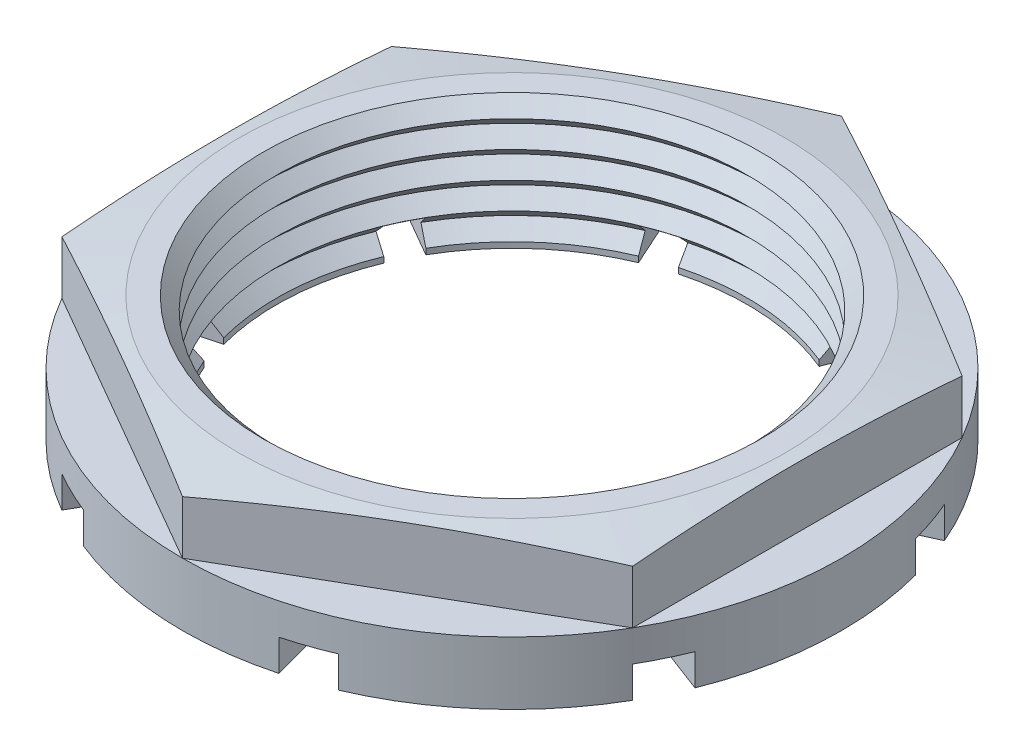
from build123d import *

# Parameters (mm, degrees)
SKETCH2_OUTSIDE_W  = 36.282
SKETCH2_OUTSIDE_H  = 36.282
CUT_EXTRUDE1_DEPTH = 2.54
CUT_EXTRUDE2_DEPTH = 1.27


with BuildPart() as part:
    # Sketch1 → Revolve1 (revolve)
    with BuildSketch(Plane(origin=(0, 0, 0), x_dir=(0, 0, -1), z_dir=(1, 0, 0)), mode=Mode.PRIVATE) as revolve1_sk:
        Polygon((9.525, -0.925479408), (13.335, -0.925479408), (13.335, 3.773520592), (11.049, 4.154520592), (10.063815367, 4.154520592), (9.525, 3.615705224), (10.063815367, 3.076889857), (9.525, 2.53807449), (10.063815367, 1.999259122), (9.525, 1.460443755), (10.063815367, 0.921628388), (9.525, 0.382813021), (10.063815367, -0.156002347), (9.525, -0.694817714), align=None)
    revolve(revolve1_sk.sketch.rotate(Axis((0, 15.090367901, 0), (0, -1, 0)), 180), axis=Axis((0, 15.090367901, 0), (0, -1, 0)))

    # Sketch2 outside → Cut-Extrude1 (cut)
    with BuildSketch(Plane(origin=(0, 4.154520592, 0), x_dir=(-1, 0, 0), z_dir=(0, 1, 0))):
        Rectangle(SKETCH2_OUTSIDE_W, SKETCH2_OUTSIDE_H)
        Polygon((0, -13.335), (11.548448759, -6.6675), (11.548448759, 6.6675), (0, 13.335), (-11.548448759, 6.6675), (-11.548448759, -6.6675), align=None, mode=Mode.SUBTRACT)
    extrude(amount=-CUT_EXTRUDE1_DEPTH, mode=Mode.SUBTRACT)

    # Sketch3 → Cut-Extrude2 (cut)
    with BuildSketch(Plane.XZ.offset(0.925479408)):
        with BuildLine():
            Line((-4.7625, 8.248891971), (-6.6675, 11.548448759))
            ThreePointArc((-6.6675, 11.548448759), (-5.833267647, 11.991464196), (-4.969767422, 12.374313588))
            Line((-4.969767422, 12.374313588), (-3.620124564, 8.810239675))
            ThreePointArc((-3.620124564, 8.810239675), (-4.20069952, 8.548669402), (-4.7625, 8.248891971))
        make_face()
        with BuildLine():
            Line((2.465251405, 9.200443495), (3.451351966, 12.880620894))
            ThreePointArc((3.451351966, 12.880620894), (4.354502539, 12.603988759), (5.235804805, 12.264117296))
            Line((5.235804805, 12.264117296), (3.66996559, 8.789594847))
            ThreePointArc((3.66996559, 8.789594847), (3.074478988, 9.015165221), (2.465251405, 9.200443495))
        make_face()
        with BuildLine():
            Line((8.248891971, 4.7625), (11.548448759, 6.6675))
            ThreePointArc((11.548448759, 6.6675), (11.991464196, 5.833267647), (12.374313588, 4.969767422))
            Line((12.374313588, 4.969767422), (8.810239675, 3.620124564))
            ThreePointArc((8.810239675, 3.620124564), (8.548669402, 4.20069952), (8.248891971, 4.7625))
        make_face()
        with BuildLine():
            Line((9.200443495, -2.465251405), (12.880620894, -3.451351966))
            ThreePointArc((12.880620894, -3.451351966), (12.603988759, -4.354502539), (12.264117296, -5.235804805))
            Line((12.264117296, -5.235804805), (8.789594847, -3.66996559))
            ThreePointArc((8.789594847, -3.66996559), (9.015165221, -3.074478988), (9.200443495, -2.465251405))
        make_face()
        with BuildLine():
            Line((4.7625, -8.248891971), (6.6675, -11.548448759))
            ThreePointArc((6.6675, -11.548448759), (5.833267647, -11.991464196), (4.969767422, -12.374313588))
            Line((4.969767422, -12.374313588), (3.620124564, -8.810239675))
            ThreePointArc((3.620124564, -8.810239675), (4.20069952, -8.548669402), (4.7625, -8.248891971))
        make_face()
        with BuildLine():
            Line((-2.465251405, -9.200443495), (-3.451351966, -12.880620894))
            ThreePointArc((-3.451351966, -12.880620894), (-4.354502539, -12.603988759), (-5.235804805, -12.264117296))
            Line((-5.235804805, -12.264117296), (-3.66996559, -8.789594847))
            ThreePointArc((-3.66996559, -8.789594847), (-3.074478988, -9.015165221), (-2.465251405, -9.200443495))
        make_face()
        with BuildLine():
            Line((-8.248891971, -4.7625), (-11.548448759, -6.6675))
            ThreePointArc((-11.548448759, -6.6675), (-11.991464196, -5.833267647), (-12.374313588, -4.969767422))
            Line((-12.374313588, -4.969767422), (-8.810239675, -3.620124564))
            ThreePointArc((-8.810239675, -3.620124564), (-8.548669402, -4.20069952), (-8.248891971, -4.7625))
        make_face()
        with BuildLine():
            Line((-9.200443495, 2.465251405), (-12.880620894, 3.451351966))
            ThreePointArc((-12.880620894, 3.451351966), (-12.603988759, 4.354502539), (-12.264117296, 5.235804805))
            Line((-12.264117296, 5.235804805), (-8.789594847, 3.66996559))
            ThreePointArc((-8.789594847, 3.66996559), (-9.015165221, 3.074478988), (-9.200443495, 2.465251405))
        make_face()
    extrude(amount=-CUT_EXTRUDE2_DEPTH, mode=Mode.SUBTRACT)


solid = part.part
